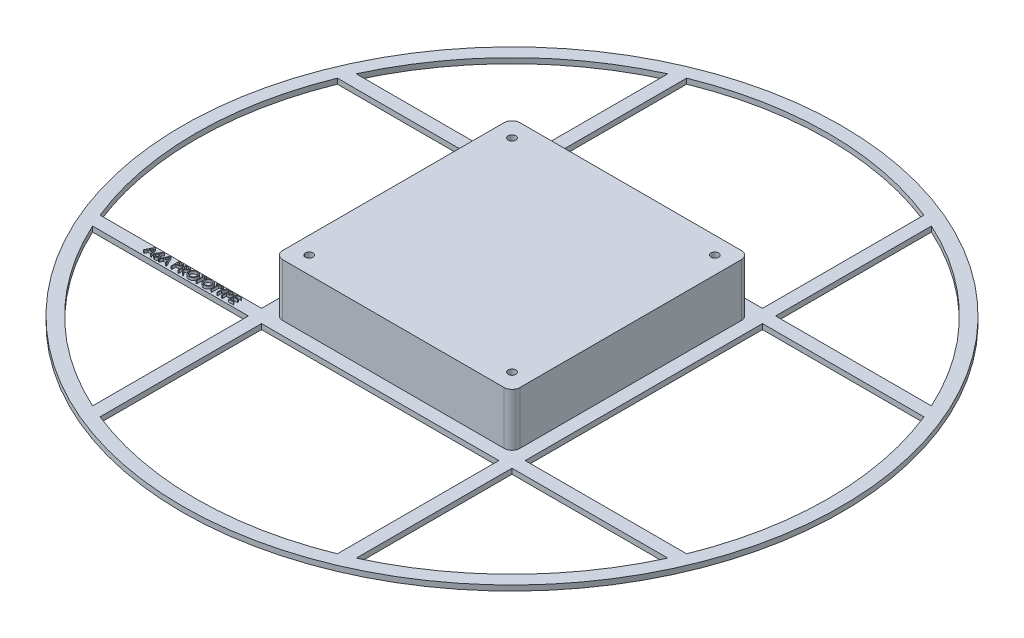
from build123d import *

# Parameters (mm, degrees)
SKETCH1_R                                     = 125
SKETCH1_R_2                                   = 120
BOSS_EXTRUDE1_DEPTH                           = 2
SKETCH1_W                                     = 100
SKETCH1_H                                     = 100
BOSS_EXTRUDE1_2_DEPTH                         = 2
BOSS_EXTRUDE2_REACH                           = 217.067
BOSS_EXTRUDE2_END_RADIUS                      = 120
SKETCH2_W                                     = 5
SKETCH2_H                                     = 2
MIRROR1_AT_THE_SECOND_PLANE_COPY_1_REACH      = 217.067
MIRROR1_AT_THE_SECOND_PLANE_COPY_1_END_RADIUS = 120
MIRROR1_AT_THE_SECOND_PLANE_COPY_1_SKETC_W    = 5
MIRROR1_AT_THE_SECOND_PLANE_COPY_1_SKETC_H    = 2
MIRROR3_COPY_1_REACH                          = 217.067
MIRROR3_COPY_1_END_RADIUS                     = 120
MIRROR3_COPY_1_SKETCH_W                       = 5
MIRROR3_COPY_1_SKETCH_H                       = 2
MIRROR3_COPY_2_REACH                          = 217.067
MIRROR3_COPY_2_END_RADIUS                     = 120
MIRROR3_COPY_2_SKETCH_W                       = 5
MIRROR3_COPY_2_SKETCH_H                       = 2
MIRROR3_COPY_3_REACH                          = 217.067
MIRROR3_COPY_3_END_RADIUS                     = 120
MIRROR3_COPY_3_SKETCH_W                       = 5
MIRROR3_COPY_3_SKETCH_H                       = 2
SKETCH8_W                                     = 90
SKETCH8_H                                     = 90
BOSS_EXTRUDE3_DEPTH                           = 20
FILLET1_R                                     = 3
SKETCH9_R                                     = 1.45
CUT_EXTRUDE1_DEPTH                            = 15
BOSS_EXTRUDE4_DEPTH                           = 1


with BuildPart() as part:
    # Sketch1 → Boss-Extrude1 (new body)
    with BuildSketch(Plane(origin=(0, 0, 0), x_dir=(1, 0, 0), z_dir=(0, 1, 0))):
        with Locations(Location((0, 0, 0), (0, 0, 270))):
            Circle(SKETCH1_R)
        with Locations(Location((0, 0, 0), (0, 0, 270))):
            Circle(SKETCH1_R_2, mode=Mode.SUBTRACT)
    extrude(amount=BOSS_EXTRUDE1_DEPTH)



with BuildPart() as body_2:
    # Sketch1 → Boss-Extrude1 2 (new body)
    with BuildSketch(Plane(origin=(0, 0, 0), x_dir=(1, 0, 0), z_dir=(0, 1, 0))):
        Rectangle(SKETCH1_W, SKETCH1_H)
    extrude(amount=BOSS_EXTRUDE1_2_DEPTH)


with BuildPart() as part_1:
    add(part.part)

    add(body_2.part)  # Boss-Extrude2 merges body 2
    # Boss-Extrude2: up to this cylinder (the profile starts inside it)
    boss_extrude2_end = Plane(origin=(0, 1, 0), z_dir=(0, -1, 0)) * Cylinder(BOSS_EXTRUDE2_END_RADIUS, 675.134, mode=Mode.PRIVATE)
    # Sketch2 → Boss-Extrude2 (add, up to the surface)
    with BuildSketch(Plane.ZY.offset(50), mode=Mode.PRIVATE) as boss_extrude2_sk1:
        with Locations((-47.5, 1)):
            Rectangle(SKETCH2_W, SKETCH2_H)
    boss_extrude2_tool1 = extrude(boss_extrude2_sk1.sketch, amount=BOSS_EXTRUDE2_REACH, mode=Mode.PRIVATE) & boss_extrude2_end
    boss_extrude2 = boss_extrude2_tool1.solids().sort_by_distance((-50, 1, -47.5))[0]
    add(boss_extrude2)

    # Mirror1: Boss-Extrude2 across plane
    add(boss_extrude2.mirror(Plane(origin=(0, 0, 0), x_dir=(0, 0, 1), z_dir=(1, 0, 0))))

    # Mirror1 at the second plane: Boss-Extrude2 across plane
    add(boss_extrude2.mirror(Plane.XY))

    # Mirror1 at the second plane copy 1: up to this cylinder (the profile starts inside it)
    mirror1_at_the_second_plane_copy_1_end = Plane(origin=(0, 1, 0), z_dir=(0, -1, 0)) * Cylinder(MIRROR1_AT_THE_SECOND_PLANE_COPY_1_END_RADIUS, 675.134, mode=Mode.PRIVATE)
    # Mirror1 at the second plane copy 1 sketc → Mirror1 at the second plane copy 1 (add, up to the surface)
    with BuildSketch(Plane(origin=(50, 0, 0), x_dir=(0, 0, -1), z_dir=(1, 0, 0)), mode=Mode.PRIVATE) as mirror1_at_the_second_plane_copy_1_sk1:
        with Locations((-47.5, 1)):
            Rectangle(MIRROR1_AT_THE_SECOND_PLANE_COPY_1_SKETC_W, MIRROR1_AT_THE_SECOND_PLANE_COPY_1_SKETC_H)
    mirror1_at_the_second_plane_copy_1_tool1 = extrude(mirror1_at_the_second_plane_copy_1_sk1.sketch, amount=MIRROR1_AT_THE_SECOND_PLANE_COPY_1_REACH, mode=Mode.PRIVATE) & mirror1_at_the_second_plane_copy_1_end
    add(mirror1_at_the_second_plane_copy_1_tool1.solids().sort_by_distance((-50, 1, -47.5))[0])

    # Mirror2: Boss-Extrude2 across plane
    add(boss_extrude2.mirror(Plane(origin=(0, 0, 0), x_dir=(-0.7071067811865414, 0, 0.7071067811865536), z_dir=(-0.7071067811865537, 0, -0.7071067811865414))))

    # Mirror2 at the second plane: Boss-Extrude2 across plane
    add(boss_extrude2.mirror(Plane(origin=(0, 0, 0), x_dir=(0.7071067811865538, 0, 0.7071067811865412), z_dir=(-0.7071067811865412, 0, 0.7071067811865538))))

    # Mirror3 copy 1: up to this cylinder (the profile starts inside it)
    mirror3_copy_1_end = Plane(origin=(0, 1, 0), z_dir=(0, -1, 0)) * Cylinder(MIRROR3_COPY_1_END_RADIUS, 675.134, mode=Mode.PRIVATE)
    # Mirror3 copy 1 sketch → Mirror3 copy 1 (add, up to the surface)
    with BuildSketch(Plane.XY.offset(50), mode=Mode.PRIVATE) as mirror3_copy_1_sk1:
        with Locations((-47.5, 1)):
            Rectangle(MIRROR3_COPY_1_SKETCH_W, MIRROR3_COPY_1_SKETCH_H)
    mirror3_copy_1_tool1 = extrude(mirror3_copy_1_sk1.sketch, amount=MIRROR3_COPY_1_REACH, mode=Mode.PRIVATE) & mirror3_copy_1_end
    add(mirror3_copy_1_tool1.solids().sort_by_distance((-50, 1, -47.5))[0])

    # Mirror3 copy 2: up to this cylinder (the profile starts inside it)
    mirror3_copy_2_end = Plane(origin=(0, 1, 0), z_dir=(0, -1, 0)) * Cylinder(MIRROR3_COPY_2_END_RADIUS, 675.134, mode=Mode.PRIVATE)
    # Mirror3 copy 2 sketch → Mirror3 copy 2 (add, up to the surface)
    with BuildSketch(Plane(origin=(0, 0, -50), x_dir=(-1, 0, 0), z_dir=(0, 0, -1)), mode=Mode.PRIVATE) as mirror3_copy_2_sk1:
        with Locations((-47.5, 1)):
            Rectangle(MIRROR3_COPY_2_SKETCH_W, MIRROR3_COPY_2_SKETCH_H)
    mirror3_copy_2_tool1 = extrude(mirror3_copy_2_sk1.sketch, amount=MIRROR3_COPY_2_REACH, mode=Mode.PRIVATE) & mirror3_copy_2_end
    add(mirror3_copy_2_tool1.solids().sort_by_distance((-50, 1, -47.5))[0])

    # Mirror3 copy 3: up to this cylinder (the profile starts inside it)
    mirror3_copy_3_end = Plane(origin=(0, 1, 0), z_dir=(0, -1, 0)) * Cylinder(MIRROR3_COPY_3_END_RADIUS, 675.134, mode=Mode.PRIVATE)
    # Mirror3 copy 3 sketch → Mirror3 copy 3 (add, up to the surface)
    with BuildSketch(Plane(origin=(50, 0, 0), x_dir=(0, 0, 1), z_dir=(1, 0, 0)), mode=Mode.PRIVATE) as mirror3_copy_3_sk1:
        with Locations((-47.5, -1)):
            Rectangle(MIRROR3_COPY_3_SKETCH_W, MIRROR3_COPY_3_SKETCH_H)
    mirror3_copy_3_tool1 = extrude(mirror3_copy_3_sk1.sketch, amount=MIRROR3_COPY_3_REACH, mode=Mode.PRIVATE) & mirror3_copy_3_end
    add(mirror3_copy_3_tool1.solids().sort_by_distance((-50, 1, -47.5))[0])

    # Sketch8 → Boss-Extrude3 (add)
    with BuildSketch(Plane(origin=(0, 2, 0), x_dir=(1, 0, 0), z_dir=(0, 1, 0))):
        Rectangle(SKETCH8_W, SKETCH8_H)
    extrude(amount=BOSS_EXTRUDE3_DEPTH)

    # Fillet1
    fillet1_edges = [part_1.edges().sort_by_distance(p)[0] for p in [
        (-45, 12, -45),
        (-45, 12, 45),
        (45, 12, 45),
        (45, 12, -45),
    ]]
    fillet(fillet1_edges, radius=FILLET1_R)

    # Sketch9 → Cut-Extrude1 (cut)
    with BuildSketch(Plane(origin=(0, 22, 0), x_dir=(1, 0, 0), z_dir=(0, 1, 0))):
        with Locations(Location((-38.464466094, 38.464466094, 0), (0, 0, 270))):
            Circle(SKETCH9_R)
        with Locations(Location((38.464466094, 38.464466094, 0), (0, 0, 270))):
            Circle(SKETCH9_R)
        with Locations(Location((38.464466094, -38.464466094, 0), (0, 0, 270))):
            Circle(SKETCH9_R)
        with Locations(Location((-38.464466094, -38.464466094, 0), (0, 0, 270))):
            Circle(SKETCH9_R)
    extrude(amount=-CUT_EXTRUDE1_DEPTH, mode=Mode.SUBTRACT)

    # Sketch11 → Boss-Extrude4 (add)
    # profile 1 of 12: a face of its own
    with BuildSketch(Plane(origin=(0, 2, 0), x_dir=(1, 0, 0), z_dir=(0, 1, 0))):
        Polygon((-89.096375397, -46.03001149), (-87.630990782, -49.20501149), (-87.940731367, -49.20501149), (-88.410112376, -48.187383284), (-89.849420269, -48.187383284), (-90.331521631, -49.20501149), (-90.643170269, -49.20501149), (-89.137080525, -46.03001149), align=None)
        Polygon((-89.119908049, -46.649492659), (-89.694231968, -47.861742259), (-88.560212537, -47.861742259), align=None, mode=Mode.SUBTRACT)
    # profile 2 of 12: a face of its own
    with BuildSketch(Plane(origin=(0, 2, 0), x_dir=(1, 0, 0), z_dir=(0, 1, 0))):
        with BuildLine():
            Line((-85.880670269, -45.948601233), (-85.66060817, -46.12096201))
            Line((-85.66060817, -46.12096201), (-86.499515421, -47.403809567))
            add(Edge.make_bspline(
                [(-86.499515421, -47.403809567), (-86.443662384, -47.394906993), (-86.334714721, -47.377541517), (-86.224437084, -47.374676809), (-86.170694307, -47.37328072)],
                knots=[0, 0, 0, 0, 1.025318673, 2, 2, 2, 2], degree=3))
            add(Edge.make_bspline(
                [(-86.170694307, -47.37328072), (-86.138423347, -47.374135489), (-86.075109031, -47.375812509), (-85.98207751, -47.389065485), (-85.892662803, -47.409693669), (-85.807064384, -47.439884269), (-85.725173615, -47.47843787), (-85.646522231, -47.524647274), (-85.572588244, -47.580895127), (-85.50241968, -47.64372838), (-85.438713669, -47.713321633), (-85.382311105, -47.787164277), (-85.334933943, -47.865179361), (-85.296494743, -47.947327376), (-85.266645318, -48.03348169), (-85.244885097, -48.123532073), (-85.23202218, -48.217540623), (-85.230275485, -48.281474396), (-85.229388218, -48.313950792)],
                knots=[0, 0, 0, 0, 1.044136307, 2.048553127, 3.035567123, 4.010001674, 4.980053131, 5.96154148, 6.956538004, 7.981742224, 9.006487041, 10.005615874, 10.984750588, 11.954802044, 12.935714515, 13.930994945, 14.949008866, 16, 16, 16, 16], degree=3))
            add(Edge.make_bspline(
                [(-85.229388218, -48.313950792), (-85.230679177, -48.358382381), (-85.23321948, -48.445813232), (-85.258532209, -48.573154959), (-85.297865601, -48.694469455), (-85.354088073, -48.807819832), (-85.423922092, -48.913050734), (-85.50908248, -49.006291835), (-85.606549073, -49.089449655), (-85.716754954, -49.158988159), (-85.8353575, -49.21577807), (-85.959955383, -49.256567968), (-86.08933858, -49.28168083), (-86.177154189, -49.284829162), (-86.221575718, -49.286421746)],
                knots=[0, 0, 0, 0, 1.031375318, 2.029502543, 3.004789286, 3.987476834, 4.960371455, 5.9300674, 6.912260825, 7.929083631, 8.949397511, 9.960523116, 10.96833055, 12, 12, 12, 12], degree=3))
            add(Edge.make_bspline(
                [(-86.221575718, -49.286421746), (-86.264299153, -49.285035445), (-86.348926799, -49.282289426), (-86.473416548, -49.257827468), (-86.593035142, -49.218178882), (-86.706944509, -49.163555929), (-86.812463922, -49.094560564), (-86.906866321, -49.011500496), (-86.989681002, -48.916151196), (-87.058600837, -48.808527452), (-87.113264115, -48.692875848), (-87.154257833, -48.572282856), (-87.178202997, -48.447187873), (-87.181549045, -48.362387125), (-87.183234372, -48.319674951)],
                knots=[0, 0, 0, 0, 1.012016664, 2.004627821, 2.994792927, 3.992885782, 4.990978636, 5.973936114, 6.964471063, 7.975201453, 8.993600317, 9.990122807, 10.98767138, 12, 12, 12, 12], degree=3))
            add(Edge.make_bspline(
                [(-87.183234372, -48.319674951), (-87.182162632, -48.286977365), (-87.179974345, -48.220215141), (-87.164694984, -48.119101345), (-87.140143349, -48.01564072), (-87.112647625, -47.927870845), (-87.083595822, -47.855969321), (-87.059418161, -47.797999726), (-87.029324607, -47.738345038), (-86.997235897, -47.674959669), (-86.960263595, -47.609477169), (-86.92006297, -47.540803126), (-86.875522572, -47.47002972), (-86.844298567, -47.422001772), (-86.828336535, -47.39744939)],
                knots=[0, 0, 0, 0, 1.173818275, 2.396712641, 3.66331629, 4.989737886, 5.693666774, 6.447286557, 7.243889047, 8.091586357, 8.998013824, 9.943181721, 10.948533338, 12, 12, 12, 12], degree=3))
            Line((-86.828336535, -47.39744939), (-85.880670269, -45.948601233))
        make_face()
        with BuildLine():
            add(Edge.make_bspline(
                [(-86.230479964, -47.698921746), (-86.254665656, -47.699636909), (-86.302117783, -47.701040052), (-86.371649339, -47.708964606), (-86.437277824, -47.723980722), (-86.499757166, -47.743400405), (-86.558420474, -47.769856443), (-86.613994988, -47.801558291), (-86.665841077, -47.839539888), (-86.713705654, -47.882416824), (-86.757079985, -47.929404373), (-86.794438439, -47.979720965), (-86.826661997, -48.032167274), (-86.852862021, -48.087178029), (-86.873263709, -48.144733108), (-86.888021343, -48.204567559), (-86.896234387, -48.267082683), (-86.897600754, -48.309475738), (-86.898298474, -48.331123268)],
                knots=[0, 0, 0, 0, 1.128956033, 2.215002439, 3.259141796, 4.2666399, 5.263148119, 6.255916712, 7.247353359, 8.256307737, 9.250603402, 10.226115518, 11.176314381, 12.118911324, 13.063945463, 14.021379252, 14.989639887, 16, 16, 16, 16], degree=3))
            add(Edge.make_bspline(
                [(-86.898298474, -48.331123268), (-86.897730275, -48.352577179), (-86.89661612, -48.394645103), (-86.886499373, -48.456638502), (-86.87104612, -48.516296669), (-86.848058761, -48.573312047), (-86.820638655, -48.628553707), (-86.784438825, -48.680020716), (-86.744327884, -48.730838923), (-86.696381816, -48.777104543), (-86.644925622, -48.820154481), (-86.589951674, -48.857782997), (-86.532656568, -48.889974025), (-86.472266778, -48.915202664), (-86.409639101, -48.935907553), (-86.344251741, -48.950477609), (-86.276059222, -48.958714943), (-86.22986575, -48.96008309), (-86.206311295, -48.96078072)],
                knots=[0, 0, 0, 0, 0.989467248, 1.94019797, 2.891935182, 3.827694429, 4.772920941, 5.730924762, 6.725747692, 7.756678648, 8.79901574, 9.819492441, 10.826891316, 11.826466727, 12.835195252, 13.867842842, 14.912794438, 16, 16, 16, 16], degree=3))
            add(Edge.make_bspline(
                [(-86.206311295, -48.96078072), (-86.182756878, -48.960083036), (-86.136563481, -48.958714781), (-86.068370414, -48.950478224), (-86.002985082, -48.935905294), (-85.940350035, -48.915210852), (-85.879987451, -48.889943649), (-85.822742454, -48.857983265), (-85.768288397, -48.819923072), (-85.716798425, -48.777178112), (-85.669051924, -48.730575597), (-85.627978964, -48.680474349), (-85.592887745, -48.628137744), (-85.564372447, -48.573529658), (-85.541638275, -48.516262194), (-85.526106659, -48.456647737), (-85.516010804, -48.394642685), (-85.514893778, -48.352576362), (-85.514324115, -48.331123268)],
                knots=[0, 0, 0, 0, 1.087397944, 2.132534446, 3.165364764, 4.174271784, 5.174024072, 6.181601208, 7.194203697, 8.236725232, 9.267838612, 10.269026844, 11.221737037, 12.171628256, 13.107553087, 14.05945871, 15.010357665, 16, 16, 16, 16], degree=3))
            add(Edge.make_bspline(
                [(-85.514324115, -48.331123268), (-85.51482331, -48.309447498), (-85.515803068, -48.266905011), (-85.526884669, -48.204595514), (-85.542253856, -48.14442913), (-85.565461194, -48.08678368), (-85.595611965, -48.031887834), (-85.632334361, -47.97945972), (-85.674825399, -47.929115186), (-85.72387151, -47.882296389), (-85.777261952, -47.839804245), (-85.833669118, -47.801415702), (-85.893444065, -47.770151535), (-85.955508292, -47.74331042), (-86.020609347, -47.724288548), (-86.088036143, -47.708917723), (-86.15842759, -47.701106299), (-86.206296427, -47.699654966), (-86.230479964, -47.698921746)],
                knots=[0, 0, 0, 0, 0.978753431, 1.920974676, 2.853199117, 3.782215702, 4.721507756, 5.67862441, 6.671401678, 7.694929396, 8.738190014, 9.75360867, 10.774035531, 11.783329636, 12.805060902, 13.835252836, 14.906360638, 16, 16, 16, 16], degree=3))
        make_face(mode=Mode.SUBTRACT)
    # profile 3 of 12: a face of its own
    with BuildSketch(Plane(origin=(0, 2, 0), x_dir=(1, 0, 0), z_dir=(0, 1, 0))):
        Polygon((-83.316247192, -46.03001149), (-81.850862577, -49.20501149), (-82.160603162, -49.20501149), (-82.629984171, -48.187383284), (-84.069292064, -48.187383284), (-84.551393426, -49.20501149), (-84.863042064, -49.20501149), (-83.35695232, -46.03001149), align=None)
        Polygon((-83.339779844, -46.649492659), (-83.914103763, -47.861742259), (-82.780084331, -47.861742259), align=None, mode=Mode.SUBTRACT)
    # profile 4 of 12: a face of its own
    with BuildSketch(Plane(origin=(0, 2, 0), x_dir=(1, 0, 0), z_dir=(0, 1, 0))):
        with BuildLine():
            Line((-80.059836936, -46.03001149), (-79.437175678, -46.03001149))
            add(Edge.make_bspline(
                [(-79.437175678, -46.03001149), (-79.394348641, -46.030058567), (-79.312290138, -46.030148769), (-79.194620052, -46.032883574), (-79.087749795, -46.036536359), (-78.991909807, -46.041599934), (-78.906805203, -46.047583983), (-78.832821082, -46.055976905), (-78.769375913, -46.064740173), (-78.731360776, -46.073649592), (-78.714023634, -46.077712812)],
                knots=[0, 0, 0, 0, 1.415646017, 2.712440637, 3.8905458, 4.950247383, 5.884950622, 6.709939814, 7.411656543, 8, 8, 8, 8], degree=3))
            add(Edge.make_bspline(
                [(-78.714023634, -46.077712812), (-78.692076643, -46.083719866), (-78.648699814, -46.095592426), (-78.586196725, -46.119372018), (-78.526730022, -46.147567983), (-78.47009568, -46.179702557), (-78.416989647, -46.217154461), (-78.366619596, -46.258405529), (-78.319430042, -46.304408166), (-78.275686351, -46.354646409), (-78.235513713, -46.408276885), (-78.200924644, -46.466100193), (-78.171962088, -46.527143018), (-78.147121549, -46.591362901), (-78.129243165, -46.659299123), (-78.115774906, -46.730479641), (-78.107226329, -46.804896824), (-78.106407577, -46.855751132), (-78.105990782, -46.881639094)],
                knots=[0, 0, 0, 0, 0.999701418, 1.975846123, 2.934577507, 3.890451536, 4.834027766, 5.787354733, 6.749476667, 7.726910423, 8.712836071, 9.690891519, 10.682875813, 11.679750201, 12.712814741, 13.765529915, 14.8625177, 16, 16, 16, 16], degree=3))
            add(Edge.make_bspline(
                [(-78.105990782, -46.881639094), (-78.106373074, -46.907744648), (-78.107121055, -46.958821929), (-78.1160984, -47.033545816), (-78.128190788, -47.104954641), (-78.146784542, -47.172890071), (-78.171137403, -47.236948663), (-78.199705194, -47.298109352), (-78.234161682, -47.355331626), (-78.273753778, -47.408823225), (-78.31779701, -47.45863436), (-78.366105032, -47.504404066), (-78.418482819, -47.545864431), (-78.47476391, -47.583108399), (-78.535496988, -47.61527231), (-78.599760941, -47.644080722), (-78.668114352, -47.668275185), (-78.715415061, -47.681002455), (-78.739464339, -47.687473429)],
                knots=[0, 0, 0, 0, 1.121902311, 2.195077645, 3.232258892, 4.234102512, 5.217864754, 6.176164875, 7.132989551, 8.084763148, 9.034132444, 9.988522005, 10.94243251, 11.903244335, 12.886203696, 13.894208494, 14.929344452, 16, 16, 16, 16], degree=3))
            add(Edge.make_bspline(
                [(-78.739464339, -47.687473429), (-78.759355564, -47.691703419), (-78.802948339, -47.700973688), (-78.874742094, -47.711322788), (-78.958331122, -47.720156183), (-79.053601334, -47.726779357), (-79.160467212, -47.732449335), (-79.278986566, -47.736956105), (-79.409392051, -47.739432473), (-79.500352394, -47.739560192), (-79.547842745, -47.739626874)],
                knots=[0, 0, 0, 0, 0.601384939, 1.31797006, 2.144135048, 3.087295005, 4.142315834, 5.309527816, 6.595305764, 8, 8, 8, 8], degree=3))
            Line((-79.547842745, -47.739626874), (-79.774901038, -47.739626874))
            Line((-79.774901038, -47.739626874), (-79.774901038, -49.20501149))
            Line((-79.774901038, -49.20501149), (-80.059836936, -49.20501149))
            Line((-80.059836936, -49.20501149), (-80.059836936, -46.03001149))
        make_face()
        with BuildLine():
            Line((-79.774901038, -46.355652515), (-79.774901038, -47.413985849))
            Line((-79.774901038, -47.413985849), (-79.219021631, -47.420982042))
            add(Edge.make_bspline(
                [(-79.219021631, -47.420982042), (-79.191879984, -47.42099607), (-79.139483594, -47.42102315), (-79.06379502, -47.417407983), (-78.993573738, -47.413234643), (-78.929035445, -47.407124198), (-78.870151047, -47.398487057), (-78.81682236, -47.389767838), (-78.769462896, -47.377153688), (-78.714037192, -47.360169189), (-78.65227587, -47.331201745), (-78.585086022, -47.289155773), (-78.528144133, -47.235561131), (-78.478869678, -47.175301598), (-78.439766489, -47.108264531), (-78.411140696, -47.03653771), (-78.394321217, -46.960856732), (-78.392065885, -46.909069634), (-78.390926679, -46.882911129)],
                knots=[0, 0, 0, 0, 1.160613943, 2.240541288, 3.23993089, 4.169200891, 5.011653406, 5.7853311, 6.478053781, 7.106038997, 8.262395093, 9.384106736, 10.481365981, 11.59014053, 12.70357646, 13.786202915, 14.881775077, 16, 16, 16, 16], degree=3))
            add(Edge.make_bspline(
                [(-78.390926679, -46.882911129), (-78.39207208, -46.857385478), (-78.394348995, -46.806643642), (-78.411272528, -46.732277194), (-78.439710834, -46.661306234), (-78.479132173, -46.595109221), (-78.526975913, -46.53506652), (-78.582583174, -46.482908412), (-78.645823061, -46.440978725), (-78.704649671, -46.413915676), (-78.756902175, -46.397391819), (-78.80228831, -46.385830428), (-78.853533422, -46.3765997), (-78.910654193, -46.369125294), (-78.973207893, -46.362726797), (-79.041731935, -46.358385232), (-79.11596674, -46.355843911), (-79.167502044, -46.355717858), (-79.194216944, -46.355652515)],
                knots=[0, 0, 0, 0, 1.120700087, 2.227813068, 3.331159281, 4.466773991, 5.599788987, 6.693661531, 7.80175334, 8.91857717, 9.525282508, 10.207424825, 10.974604443, 11.810962634, 12.737642355, 13.736264703, 14.826523623, 16, 16, 16, 16], degree=3))
            Line((-79.194216944, -46.355652515), (-79.774901038, -46.355652515))
        make_face(mode=Mode.SUBTRACT)
    # profile 5 of 12: a face of its own
    with BuildSketch(Plane(origin=(0, 2, 0), x_dir=(1, 0, 0), z_dir=(0, 1, 0))):
        with BuildLine():
            Line((-77.45470873, -46.03001149), (-76.81932712, -46.03001149))
            add(Edge.make_bspline(
                [(-76.81932712, -46.03001149), (-76.776926239, -46.030152628), (-76.695511851, -46.03042363), (-76.578877527, -46.031934715), (-76.472898661, -46.036265738), (-76.377630663, -46.03999281), (-76.293075284, -46.046789071), (-76.218973241, -46.053284801), (-76.15566583, -46.06178805), (-76.117342808, -46.069685113), (-76.099991182, -46.073260688)],
                knots=[0, 0, 0, 0, 1.410062039, 2.707475311, 3.878576406, 4.937260626, 5.877586885, 6.699081471, 7.410979367, 8, 8, 8, 8], degree=3))
            add(Edge.make_bspline(
                [(-76.099991182, -46.073260688), (-76.076762316, -46.078999968), (-76.030800119, -46.090356094), (-75.964623987, -46.114358732), (-75.901564565, -46.142135106), (-75.841883796, -46.174759338), (-75.785880614, -46.212473602), (-75.732977575, -46.254626827), (-75.682934619, -46.300988364), (-75.637775568, -46.352727113), (-75.595195143, -46.407007375), (-75.559282603, -46.465702926), (-75.528325011, -46.527081598), (-75.50367747, -46.591767612), (-75.483831023, -46.659133648), (-75.46983722, -46.729789914), (-75.461445071, -46.803414513), (-75.460590674, -46.853632044), (-75.460157448, -46.879095023)],
                knots=[0, 0, 0, 0, 1.027469482, 2.033020251, 3.019912614, 3.986113645, 4.951240523, 5.91722682, 6.890402269, 7.87763091, 8.8651537, 9.85103654, 10.82876324, 11.815024772, 12.821070561, 13.842952187, 14.906261191, 16, 16, 16, 16], degree=3))
            add(Edge.make_bspline(
                [(-75.460157448, -46.879095023), (-75.46149004, -46.921399725), (-75.46409027, -47.003947156), (-75.488333757, -47.123745241), (-75.528045314, -47.235495548), (-75.582767155, -47.33905737), (-75.652453394, -47.432412027), (-75.736205168, -47.514409083), (-75.834069202, -47.583025289), (-75.925172938, -47.630607476), (-76.005649391, -47.661081043), (-76.071901039, -47.682522597), (-76.144170368, -47.699088809), (-76.221764951, -47.713929785), (-76.305007695, -47.725134537), (-76.393699088, -47.73334109), (-76.487902383, -47.73847012), (-76.55261711, -47.739233939), (-76.58590865, -47.739626874)],
                knots=[0, 0, 0, 0, 1.260483769, 2.459530307, 3.627416485, 4.787058657, 5.939039949, 7.08810263, 8.267026773, 9.491475466, 10.141966685, 10.831826277, 11.566392101, 12.351337768, 13.187381173, 14.07005841, 15.007169909, 16, 16, 16, 16], degree=3))
            Line((-76.58590865, -47.739626874), (-75.41945232, -49.20501149))
            Line((-75.41945232, -49.20501149), (-75.771806086, -49.20501149))
            Line((-75.771806086, -49.20501149), (-76.938262416, -47.739626874))
            Line((-76.938262416, -47.739626874), (-77.169772833, -47.739626874))
            Line((-77.169772833, -47.739626874), (-77.169772833, -49.20501149))
            Line((-77.169772833, -49.20501149), (-77.45470873, -49.20501149))
            Line((-77.45470873, -49.20501149), (-77.45470873, -46.03001149))
        make_face()
        with BuildLine():
            Line((-77.169772833, -46.355652515), (-77.169772833, -47.413985849))
            Line((-77.169772833, -47.413985849), (-76.588452721, -47.418437972))
            add(Edge.make_bspline(
                [(-76.588452721, -47.418437972), (-76.561310971, -47.418449979), (-76.50870253, -47.418473254), (-76.432592641, -47.414850328), (-76.36172654, -47.410728889), (-76.296375286, -47.40442484), (-76.236509686, -47.396300404), (-76.182159661, -47.386137696), (-76.133236492, -47.374297611), (-76.076178533, -47.35597185), (-76.012463965, -47.32693782), (-75.943220426, -47.28469626), (-75.88425402, -47.231565702), (-75.834435673, -47.17081121), (-75.794403975, -47.104012613), (-75.766180897, -47.031970621), (-75.748271681, -46.956503957), (-75.746159358, -46.904635244), (-75.745093346, -46.878459006)],
                knots=[0, 0, 0, 0, 1.146690395, 2.22261258, 3.21895312, 4.145990853, 4.996080663, 5.770904154, 6.481378293, 7.121626537, 8.300444488, 9.431385265, 10.535395872, 11.636531494, 12.74115979, 13.810798291, 14.895190096, 16, 16, 16, 16], degree=3))
            add(Edge.make_bspline(
                [(-75.745093346, -46.878459006), (-75.746183841, -46.852926042), (-75.748344806, -46.802329026), (-75.765987617, -46.72825545), (-75.795822985, -46.658344717), (-75.836029586, -46.59288122), (-75.885014534, -46.533458159), (-75.942452835, -46.482615385), (-76.006773977, -46.440660513), (-76.066891421, -46.413850468), (-76.120625314, -46.397413172), (-76.167279362, -46.385846045), (-76.219994774, -46.376552849), (-76.279027512, -46.369106965), (-76.344125563, -46.362707122), (-76.415618082, -46.35839658), (-76.493030732, -46.355844004), (-76.546685449, -46.35571783), (-76.574460333, -46.355652515)],
                knots=[0, 0, 0, 0, 1.101028733, 2.181837193, 3.264309656, 4.369019818, 5.486613113, 6.575447106, 7.666700264, 8.788928104, 9.402425223, 10.0903467, 10.862060571, 11.710948788, 12.657782767, 13.684531032, 14.801375019, 16, 16, 16, 16], degree=3))
            Line((-76.574460333, -46.355652515), (-77.169772833, -46.355652515))
        make_face(mode=Mode.SUBTRACT)
    # profile 6 of 12: a face of its own
    with BuildSketch(Plane(origin=(0, 2, 0), x_dir=(1, 0, 0), z_dir=(0, 1, 0))):
        with BuildLine():
            add(Edge.make_bspline(
                [(-73.282433089, -45.948601233), (-73.223642879, -45.950090289), (-73.108174056, -45.953014919), (-72.938470398, -45.975402391), (-72.776459133, -46.014133209), (-72.620820507, -46.065716058), (-72.473416164, -46.134526822), (-72.333136598, -46.217698349), (-72.200315576, -46.316101994), (-72.076743323, -46.428977078), (-71.963661661, -46.551789211), (-71.864033893, -46.682851316), (-71.780538383, -46.821370943), (-71.711971277, -46.96693184), (-71.658178966, -47.119204811), (-71.621059548, -47.279001656), (-71.597348512, -47.445287011), (-71.594576485, -47.558704238), (-71.593170269, -47.616239454)],
                knots=[0, 0, 0, 0, 1.065120563, 2.091984664, 3.0946048, 4.079830382, 5.057816894, 6.036188127, 7.030412546, 8.04752943, 9.064399622, 10.05169764, 11.02544977, 11.989514704, 12.962713494, 13.945757189, 14.957906945, 16, 16, 16, 16], degree=3))
            add(Edge.make_bspline(
                [(-71.593170269, -47.616239454), (-71.594576279, -47.673350852), (-71.597347688, -47.785924033), (-71.621086508, -47.951154158), (-71.658316558, -48.109986433), (-71.711471742, -48.262155703), (-71.779711998, -48.407822493), (-71.863763474, -48.546603516), (-71.962770144, -48.678544268), (-72.075443502, -48.802199328), (-72.19827159, -48.915589891), (-72.330016189, -49.014394871), (-72.467714415, -49.099416041), (-72.613138222, -49.167255517), (-72.764358969, -49.221477188), (-72.922730077, -49.258445645), (-73.087509451, -49.282291748), (-73.199878147, -49.285029974), (-73.256992384, -49.286421746)],
                knots=[0, 0, 0, 0, 1.043624062, 2.057103931, 3.04512605, 4.022047818, 4.998200453, 5.980619268, 6.982898556, 8.009068085, 9.034988726, 10.034168286, 11.015286542, 11.987931943, 12.962482838, 13.94673481, 14.956375938, 16, 16, 16, 16], degree=3))
            add(Edge.make_bspline(
                [(-73.256992384, -49.286421746), (-73.314527302, -49.285016231), (-73.427943941, -49.282245586), (-73.594438252, -49.258495312), (-73.754347348, -49.2213557), (-73.907213938, -49.168279283), (-74.053123267, -49.099683653), (-74.192360699, -49.016041109), (-74.324367354, -48.916793202), (-74.448048796, -48.804156381), (-74.56121414, -48.681536473), (-74.65987443, -48.550151113), (-74.743535783, -48.412577949), (-74.811901092, -48.268435195), (-74.86602528, -48.118419672), (-74.902950365, -47.961530696), (-74.926840836, -47.798662715), (-74.929593875, -47.687770943), (-74.930990782, -47.631503877)],
                knots=[0, 0, 0, 0, 1.053102029, 2.075944431, 3.073151272, 4.055350789, 5.033113405, 6.020478099, 7.024410459, 8.052272461, 9.079885166, 10.07527673, 11.055994387, 12.023226415, 12.992069828, 13.970394897, 14.97016774, 16, 16, 16, 16], degree=3))
            add(Edge.make_bspline(
                [(-74.930990782, -47.631503877), (-74.930505791, -47.593737099), (-74.929541928, -47.518679987), (-74.917938035, -47.407222428), (-74.901099921, -47.297557332), (-74.876968186, -47.189996543), (-74.845407174, -47.084803364), (-74.80816712, -46.981252315), (-74.762683118, -46.880392794), (-74.711265673, -46.781747003), (-74.653878175, -46.686852688), (-74.590490888, -46.597154781), (-74.523330233, -46.511900591), (-74.44970344, -46.43329938), (-74.372037093, -46.359064563), (-74.289071279, -46.290336956), (-74.201312243, -46.226496822), (-74.10838237, -46.168965512), (-74.012571506, -46.116932583), (-73.913804715, -46.072281333), (-73.813423396, -46.03395812), (-73.710957394, -46.0028968), (-73.606678808, -45.978374881), (-73.500360046, -45.961676782), (-73.39208581, -45.950043293), (-73.319141256, -45.949083988), (-73.282433089, -45.948601233)],
                knots=[0, 0, 0, 0, 1.037015668, 2.060948919, 3.074880161, 4.083647147, 5.086022904, 6.090072063, 7.104153813, 8.122640571, 9.144368836, 10.147691507, 11.138137339, 12.123020368, 13.103399296, 14.087645067, 15.080126199, 16.082011238, 17.087798457, 18.072939717, 19.057185487, 20.037253025, 21.01195951, 21.997135196, 22.992090687, 24, 24, 24, 24], degree=3))
        make_face()
        with BuildLine():
            add(Edge.make_bspline(
                [(-73.268440702, -46.274242259), (-73.298571119, -46.274609552), (-73.358543906, -46.275340627), (-73.447702021, -46.284970598), (-73.535687561, -46.298695569), (-73.622518696, -46.318273091), (-73.707832116, -46.344946767), (-73.792423043, -46.375645306), (-73.875520099, -46.413038724), (-73.956848956, -46.45528682), (-74.035693346, -46.502049055), (-74.110090582, -46.553730586), (-74.180233266, -46.609119418), (-74.245949658, -46.668344813), (-74.307046793, -46.73170838), (-74.3647272, -46.798249519), (-74.416678892, -46.869870163), (-74.464290809, -46.944628175), (-74.506897349, -47.022426181), (-74.544784493, -47.102445127), (-74.575776129, -47.185337743), (-74.601051285, -47.270204729), (-74.622006113, -47.356911674), (-74.635281173, -47.446116337), (-74.645016956, -47.537370475), (-74.645706244, -47.599039728), (-74.646054884, -47.630231842)],
                knots=[0, 0, 0, 0, 1.008559885, 2.007477868, 2.99961109, 3.989939068, 4.984837346, 5.991145699, 7.001802488, 8.033829008, 9.059044045, 10.069351652, 11.065060232, 12.050310815, 13.029377138, 14.011219647, 14.996725999, 15.989392538, 16.977580475, 17.965360261, 18.951710183, 19.937753436, 20.929683414, 21.935841486, 22.955955122, 24, 24, 24, 24], degree=3))
            add(Edge.make_bspline(
                [(-74.646054884, -47.630231842), (-74.644898402, -47.676099), (-74.642623245, -47.766333888), (-74.622704592, -47.898566418), (-74.592023229, -48.025646507), (-74.546795475, -48.14687881), (-74.490234561, -48.263305409), (-74.420360167, -48.373893476), (-74.33757514, -48.478672898), (-74.243537512, -48.576912177), (-74.140737628, -48.666579443), (-74.031578652, -48.745286249), (-73.917230022, -48.811879833), (-73.797393545, -48.866131577), (-73.672708992, -48.909120839), (-73.542372928, -48.938583597), (-73.407253583, -48.957974189), (-73.315150774, -48.959836332), (-73.268440702, -48.96078072)],
                knots=[0, 0, 0, 0, 1.032063989, 2.030389145, 3.003944642, 3.970395727, 4.937377036, 5.913328081, 6.909231446, 7.93887556, 8.970685674, 9.976071282, 10.964166581, 11.944589148, 12.933237628, 13.927779006, 14.949070134, 16, 16, 16, 16], degree=3))
            add(Edge.make_bspline(
                [(-73.268440702, -48.96078072), (-73.237044939, -48.96034937), (-73.174777714, -48.959493873), (-73.08216249, -48.950877216), (-72.991215783, -48.937059734), (-72.902065158, -48.917165497), (-72.814811793, -48.892266959), (-72.729091508, -48.862687092), (-72.645817344, -48.825783429), (-72.563938777, -48.785009215), (-72.485565044, -48.738527072), (-72.410747954, -48.688599608), (-72.341373315, -48.633292359), (-72.275706086, -48.574946915), (-72.214358111, -48.512386853), (-72.157744247, -48.445693509), (-72.106055127, -48.374445913), (-72.05846129, -48.299801295), (-72.016004045, -48.221790408), (-71.979011576, -48.141481343), (-71.947627957, -48.059071851), (-71.922292813, -47.974443069), (-71.902439573, -47.887755727), (-71.888759931, -47.798893756), (-71.87919099, -47.708034924), (-71.878469742, -47.646581569), (-71.878106166, -47.615603437)],
                knots=[0, 0, 0, 0, 1.047197238, 2.076906641, 3.100256066, 4.114471768, 5.12198147, 6.126382909, 7.136867548, 8.15857795, 9.17633901, 10.174870724, 11.156907918, 12.133735059, 13.104061851, 14.077631395, 15.04955518, 16.038496417, 17.029181396, 18.010275684, 18.986308667, 19.968651475, 20.955262928, 21.950658345, 22.966943676, 24, 24, 24, 24], degree=3))
            add(Edge.make_bspline(
                [(-71.878106166, -47.615603437), (-71.878470033, -47.584837229), (-71.87919183, -47.523806789), (-71.88875536, -47.433581619), (-71.902454025, -47.345359062), (-71.92219591, -47.25948547), (-71.947641407, -47.175938951), (-71.979017057, -47.094797972), (-72.01601515, -47.015760252), (-72.058476896, -46.93902114), (-72.106206965, -46.865384056), (-72.158362457, -46.794987582), (-72.21584388, -46.729153738), (-72.277008917, -46.666257266), (-72.343385363, -46.607639609), (-72.414672544, -46.553281322), (-72.490005023, -46.501870566), (-72.569767586, -46.455492378), (-72.652085316, -46.412662324), (-72.736552978, -46.375967485), (-72.822213661, -46.344787063), (-72.908849534, -46.318192387), (-72.997189807, -46.298772246), (-73.086637567, -46.284958229), (-73.177069058, -46.275343979), (-73.237886836, -46.274610664), (-73.268440702, -46.274242259)],
                knots=[0, 0, 0, 0, 1.02996197, 2.043119294, 3.035359645, 4.018872909, 4.991431989, 5.957985074, 6.929999688, 7.912076566, 8.892894881, 9.867085534, 10.843653904, 11.817741046, 12.803660682, 13.806313499, 14.818574707, 15.856120519, 16.894564902, 17.924820532, 18.937903209, 19.946497019, 20.957711757, 21.963978472, 22.977135795, 24, 24, 24, 24], degree=3))
        make_face(mode=Mode.SUBTRACT)
    # profile 7 of 12: a face of its own
    with BuildSketch(Plane(origin=(0, 2, 0), x_dir=(1, 0, 0), z_dir=(0, 1, 0))):
        Polygon((-71.308234372, -46.355652515), (-71.308234372, -46.03001149), (-69.639324115, -46.03001149), (-69.639324115, -46.355652515), (-70.331311295, -46.355652515), (-70.331311295, -49.20501149), (-70.616247192, -49.20501149), (-70.616247192, -46.355652515), align=None)
    # profile 8 of 12: a face of its own
    with BuildSketch(Plane(origin=(0, 2, 0), x_dir=(1, 0, 0), z_dir=(0, 1, 0))):
        with BuildLine():
            add(Edge.make_bspline(
                [(-67.665125397, -45.948601233), (-67.606335187, -45.950090289), (-67.490866363, -45.953014919), (-67.321162706, -45.975402391), (-67.159151441, -46.014133209), (-67.003512815, -46.065716058), (-66.856108472, -46.134526822), (-66.715828905, -46.217698349), (-66.583007884, -46.316101994), (-66.459435631, -46.428977078), (-66.346353969, -46.551789211), (-66.2467262, -46.682851316), (-66.163230691, -46.821370943), (-66.094663584, -46.96693184), (-66.040871274, -47.119204811), (-66.003751856, -47.279001656), (-65.98004082, -47.445287011), (-65.977268793, -47.558704238), (-65.975862577, -47.616239454)],
                knots=[0, 0, 0, 0, 1.065120563, 2.091984664, 3.0946048, 4.079830382, 5.057816894, 6.036188127, 7.030412546, 8.04752943, 9.064399622, 10.05169764, 11.02544977, 11.989514704, 12.962713494, 13.945757189, 14.957906945, 16, 16, 16, 16], degree=3))
            add(Edge.make_bspline(
                [(-65.975862577, -47.616239454), (-65.977268587, -47.673350852), (-65.980039996, -47.785924033), (-66.003778816, -47.951154158), (-66.041008865, -48.109986433), (-66.09416405, -48.262155703), (-66.162404305, -48.407822493), (-66.246455782, -48.546603516), (-66.345462452, -48.678544268), (-66.458135809, -48.802199328), (-66.580963898, -48.915589891), (-66.712708497, -49.014394871), (-66.850406723, -49.099416041), (-66.995830529, -49.167255517), (-67.147051277, -49.221477188), (-67.305422384, -49.258445645), (-67.470201758, -49.282291748), (-67.582570455, -49.285029974), (-67.639684692, -49.286421746)],
                knots=[0, 0, 0, 0, 1.043624062, 2.057103931, 3.04512605, 4.022047818, 4.998200453, 5.980619268, 6.982898556, 8.009068085, 9.034988726, 10.034168286, 11.015286542, 11.987931943, 12.962482838, 13.94673481, 14.956375938, 16, 16, 16, 16], degree=3))
            add(Edge.make_bspline(
                [(-67.639684692, -49.286421746), (-67.69721961, -49.285016231), (-67.810636249, -49.282245586), (-67.977130559, -49.258495312), (-68.137039656, -49.2213557), (-68.289906246, -49.168279283), (-68.435815575, -49.099683653), (-68.575053007, -49.016041109), (-68.707059662, -48.916793202), (-68.830741103, -48.804156381), (-68.943906447, -48.681536473), (-69.042566738, -48.550151113), (-69.126228091, -48.412577949), (-69.1945934, -48.268435195), (-69.248717588, -48.118419672), (-69.285642673, -47.961530696), (-69.309533144, -47.798662715), (-69.312286183, -47.687770943), (-69.313683089, -47.631503877)],
                knots=[0, 0, 0, 0, 1.053102029, 2.075944431, 3.073151272, 4.055350789, 5.033113405, 6.020478099, 7.024410459, 8.052272461, 9.079885166, 10.07527673, 11.055994387, 12.023226415, 12.992069828, 13.970394897, 14.97016774, 16, 16, 16, 16], degree=3))
            add(Edge.make_bspline(
                [(-69.313683089, -47.631503877), (-69.313198099, -47.593737099), (-69.312234236, -47.518679987), (-69.300630343, -47.407222428), (-69.283792228, -47.297557332), (-69.259660493, -47.189996543), (-69.228099481, -47.084803364), (-69.190859428, -46.981252315), (-69.145375425, -46.880392794), (-69.09395798, -46.781747003), (-69.036570483, -46.686852688), (-68.973183196, -46.597154781), (-68.90602254, -46.511900591), (-68.832395747, -46.43329938), (-68.754729401, -46.359064563), (-68.671763586, -46.290336956), (-68.58400455, -46.226496822), (-68.491074677, -46.168965512), (-68.395263814, -46.116932583), (-68.296497022, -46.072281333), (-68.196115704, -46.03395812), (-68.093649702, -46.0028968), (-67.989371116, -45.978374881), (-67.883052354, -45.961676782), (-67.774778117, -45.950043293), (-67.701833564, -45.949083988), (-67.665125397, -45.948601233)],
                knots=[0, 0, 0, 0, 1.037015668, 2.060948919, 3.074880161, 4.083647147, 5.086022904, 6.090072063, 7.104153813, 8.122640571, 9.144368836, 10.147691507, 11.138137339, 12.123020368, 13.103399296, 14.087645067, 15.080126199, 16.082011238, 17.087798457, 18.072939717, 19.057185487, 20.037253025, 21.01195951, 21.997135196, 22.992090687, 24, 24, 24, 24], degree=3))
        make_face()
        with BuildLine():
            add(Edge.make_bspline(
                [(-67.651133009, -46.274242259), (-67.681263427, -46.274609552), (-67.741236213, -46.275340627), (-67.830394328, -46.284970598), (-67.918379868, -46.298695569), (-68.005211004, -46.318273091), (-68.090524424, -46.344946767), (-68.175115351, -46.375645306), (-68.258212407, -46.413038724), (-68.339541264, -46.45528682), (-68.418385653, -46.502049055), (-68.49278289, -46.553730586), (-68.562925574, -46.609119418), (-68.628641966, -46.668344813), (-68.6897391, -46.73170838), (-68.747419508, -46.798249519), (-68.7993712, -46.869870163), (-68.846983116, -46.944628175), (-68.889589657, -47.022426181), (-68.9274768, -47.102445127), (-68.958468437, -47.185337743), (-68.983743592, -47.270204729), (-69.004698421, -47.356911674), (-69.017973481, -47.446116337), (-69.027709264, -47.537370475), (-69.028398552, -47.599039728), (-69.028747192, -47.630231842)],
                knots=[0, 0, 0, 0, 1.008559885, 2.007477868, 2.99961109, 3.989939068, 4.984837346, 5.991145699, 7.001802488, 8.033829008, 9.059044045, 10.069351652, 11.065060232, 12.050310815, 13.029377138, 14.011219647, 14.996725999, 15.989392538, 16.977580475, 17.965360261, 18.951710183, 19.937753436, 20.929683414, 21.935841486, 22.955955122, 24, 24, 24, 24], degree=3))
            add(Edge.make_bspline(
                [(-69.028747192, -47.630231842), (-69.02759071, -47.676099), (-69.025315552, -47.766333888), (-69.0053969, -47.898566418), (-68.974715537, -48.025646507), (-68.929487783, -48.14687881), (-68.872926868, -48.263305409), (-68.803052475, -48.373893476), (-68.720267447, -48.478672898), (-68.62622982, -48.576912177), (-68.523429936, -48.666579443), (-68.414270959, -48.745286249), (-68.29992233, -48.811879833), (-68.180085853, -48.866131577), (-68.0554013, -48.909120839), (-67.925065236, -48.938583597), (-67.78994589, -48.957974189), (-67.697843082, -48.959836332), (-67.651133009, -48.96078072)],
                knots=[0, 0, 0, 0, 1.032063989, 2.030389145, 3.003944642, 3.970395727, 4.937377036, 5.913328081, 6.909231446, 7.93887556, 8.970685674, 9.976071282, 10.964166581, 11.944589148, 12.933237628, 13.927779006, 14.949070134, 16, 16, 16, 16], degree=3))
            add(Edge.make_bspline(
                [(-67.651133009, -48.96078072), (-67.619737247, -48.96034937), (-67.557470021, -48.959493873), (-67.464854797, -48.950877216), (-67.373908091, -48.937059734), (-67.284757466, -48.917165497), (-67.197504101, -48.892266959), (-67.111783815, -48.862687092), (-67.028509652, -48.825783429), (-66.946631085, -48.785009215), (-66.868257351, -48.738527072), (-66.793440261, -48.688599608), (-66.724065623, -48.633292359), (-66.658398393, -48.574946915), (-66.597050418, -48.512386853), (-66.540436554, -48.445693509), (-66.488747434, -48.374445913), (-66.441153598, -48.299801295), (-66.398696352, -48.221790408), (-66.361703884, -48.141481343), (-66.330320264, -48.059071851), (-66.304985121, -47.974443069), (-66.285131881, -47.887755727), (-66.271452239, -47.798893756), (-66.261883298, -47.708034924), (-66.26116205, -47.646581569), (-66.260798474, -47.615603437)],
                knots=[0, 0, 0, 0, 1.047197238, 2.076906641, 3.100256066, 4.114471768, 5.12198147, 6.126382909, 7.136867548, 8.15857795, 9.17633901, 10.174870724, 11.156907918, 12.133735059, 13.104061851, 14.077631395, 15.04955518, 16.038496417, 17.029181396, 18.010275684, 18.986308667, 19.968651475, 20.955262928, 21.950658345, 22.966943676, 24, 24, 24, 24], degree=3))
            add(Edge.make_bspline(
                [(-66.260798474, -47.615603437), (-66.261162341, -47.584837229), (-66.261884138, -47.523806789), (-66.271447668, -47.433581619), (-66.285146333, -47.345359062), (-66.304888218, -47.25948547), (-66.330333715, -47.175938951), (-66.361709364, -47.094797972), (-66.398707458, -47.015760252), (-66.441169204, -46.93902114), (-66.488899272, -46.865384056), (-66.541054765, -46.794987582), (-66.598536188, -46.729153738), (-66.659701224, -46.666257266), (-66.72607767, -46.607639609), (-66.797364851, -46.553281322), (-66.872697331, -46.501870566), (-66.952459894, -46.455492378), (-67.034777624, -46.412662324), (-67.119245285, -46.375967485), (-67.204905969, -46.344787063), (-67.291541842, -46.318192387), (-67.379882115, -46.298772246), (-67.469329874, -46.284958229), (-67.559761366, -46.275343979), (-67.620579144, -46.274610664), (-67.651133009, -46.274242259)],
                knots=[0, 0, 0, 0, 1.02996197, 2.043119294, 3.035359645, 4.018872909, 4.991431989, 5.957985074, 6.929999688, 7.912076566, 8.892894881, 9.867085534, 10.843653904, 11.817741046, 12.803660682, 13.806313499, 14.818574707, 15.856120519, 16.894564902, 17.924820532, 18.937903209, 19.946497019, 20.957711757, 21.963978472, 22.977135795, 24, 24, 24, 24], degree=3))
        make_face(mode=Mode.SUBTRACT)
    # profile 9 of 12: a face of its own
    with BuildSketch(Plane(origin=(0, 2, 0), x_dir=(1, 0, 0), z_dir=(0, 1, 0))):
        Polygon((-65.690926679, -46.355652515), (-65.690926679, -46.03001149), (-64.022016423, -46.03001149), (-64.022016423, -46.355652515), (-64.714003602, -46.355652515), (-64.714003602, -49.20501149), (-64.9989395, -49.20501149), (-64.9989395, -46.355652515), align=None)
    # profile 10 of 12: a face of its own
    with BuildSketch(Plane(origin=(0, 2, 0), x_dir=(1, 0, 0), z_dir=(0, 1, 0))):
        Polygon((-63.777785654, -46.03001149), (-63.45150861, -46.03001149), (-62.618325517, -47.392997267), (-61.784506407, -46.03001149), (-61.457593346, -46.03001149), (-62.475221551, -47.695741658), (-62.475221551, -49.20501149), (-62.760157448, -49.20501149), (-62.760157448, -47.695741658), align=None)
    # profile 11 of 12: a face of its own
    with BuildSketch(Plane(origin=(0, 2, 0), x_dir=(1, 0, 0), z_dir=(0, 1, 0))):
        with BuildLine():
            Line((-60.887721551, -46.03001149), (-60.265060293, -46.03001149))
            add(Edge.make_bspline(
                [(-60.265060293, -46.03001149), (-60.222233257, -46.030058567), (-60.140174753, -46.030148769), (-60.022504667, -46.032883574), (-59.91563441, -46.036536359), (-59.819794422, -46.041599934), (-59.734689819, -46.047583983), (-59.660705697, -46.055976905), (-59.597260528, -46.064740173), (-59.559245392, -46.073649592), (-59.54190825, -46.077712812)],
                knots=[0, 0, 0, 0, 1.415646017, 2.712440637, 3.8905458, 4.950247383, 5.884950622, 6.709939814, 7.411656543, 8, 8, 8, 8], degree=3))
            add(Edge.make_bspline(
                [(-59.54190825, -46.077712812), (-59.519961258, -46.083719866), (-59.476584429, -46.095592426), (-59.41408134, -46.119372018), (-59.354614637, -46.147567983), (-59.297980295, -46.179702557), (-59.244874262, -46.217154461), (-59.194504211, -46.258405529), (-59.147314657, -46.304408166), (-59.103570966, -46.354646409), (-59.063398328, -46.408276885), (-59.028809259, -46.466100193), (-58.999846703, -46.527143018), (-58.975006164, -46.591362901), (-58.95712778, -46.659299123), (-58.943659521, -46.730479641), (-58.935110945, -46.804896824), (-58.934292192, -46.855751132), (-58.933875397, -46.881639094)],
                knots=[0, 0, 0, 0, 0.999701418, 1.975846123, 2.934577507, 3.890451536, 4.834027766, 5.787354733, 6.749476667, 7.726910423, 8.712836071, 9.690891519, 10.682875813, 11.679750201, 12.712814741, 13.765529915, 14.8625177, 16, 16, 16, 16], degree=3))
            add(Edge.make_bspline(
                [(-58.933875397, -46.881639094), (-58.93425769, -46.907744648), (-58.935005671, -46.958821929), (-58.943983015, -47.033545816), (-58.956075403, -47.104954641), (-58.974669158, -47.172890071), (-58.999022018, -47.236948663), (-59.027589809, -47.298109352), (-59.062046297, -47.355331626), (-59.101638393, -47.408823225), (-59.145681625, -47.45863436), (-59.193989648, -47.504404066), (-59.246367434, -47.545864431), (-59.302648526, -47.583108399), (-59.363381603, -47.61527231), (-59.427645557, -47.644080722), (-59.495998967, -47.668275185), (-59.543299676, -47.681002455), (-59.567348955, -47.687473429)],
                knots=[0, 0, 0, 0, 1.121902311, 2.195077645, 3.232258892, 4.234102512, 5.217864754, 6.176164875, 7.132989551, 8.084763148, 9.034132444, 9.988522005, 10.94243251, 11.903244335, 12.886203696, 13.894208494, 14.929344452, 16, 16, 16, 16], degree=3))
            add(Edge.make_bspline(
                [(-59.567348955, -47.687473429), (-59.587240179, -47.691703419), (-59.630832954, -47.700973688), (-59.702626709, -47.711322788), (-59.786215738, -47.720156183), (-59.881485949, -47.726779357), (-59.988351827, -47.732449335), (-60.106871182, -47.736956105), (-60.237276666, -47.739432473), (-60.328237009, -47.739560192), (-60.37572736, -47.739626874)],
                knots=[0, 0, 0, 0, 0.601384939, 1.31797006, 2.144135048, 3.087295005, 4.142315834, 5.309527816, 6.595305764, 8, 8, 8, 8], degree=3))
            Line((-60.37572736, -47.739626874), (-60.602785654, -47.739626874))
            Line((-60.602785654, -47.739626874), (-60.602785654, -49.20501149))
            Line((-60.602785654, -49.20501149), (-60.887721551, -49.20501149))
            Line((-60.887721551, -49.20501149), (-60.887721551, -46.03001149))
        make_face()
        with BuildLine():
            Line((-60.602785654, -46.355652515), (-60.602785654, -47.413985849))
            Line((-60.602785654, -47.413985849), (-60.046906247, -47.420982042))
            add(Edge.make_bspline(
                [(-60.046906247, -47.420982042), (-60.0197646, -47.42099607), (-59.96736821, -47.42102315), (-59.891679636, -47.417407983), (-59.821458354, -47.413234643), (-59.75692006, -47.407124198), (-59.698035663, -47.398487057), (-59.644706976, -47.389767838), (-59.597347512, -47.377153688), (-59.541921807, -47.360169189), (-59.480160485, -47.331201745), (-59.412970637, -47.289155773), (-59.356028748, -47.235561131), (-59.306754293, -47.175301598), (-59.267651104, -47.108264531), (-59.239025311, -47.03653771), (-59.222205833, -46.960856732), (-59.2199505, -46.909069634), (-59.218811295, -46.882911129)],
                knots=[0, 0, 0, 0, 1.160613943, 2.240541288, 3.23993089, 4.169200891, 5.011653406, 5.7853311, 6.478053781, 7.106038997, 8.262395093, 9.384106736, 10.481365981, 11.59014053, 12.70357646, 13.786202915, 14.881775077, 16, 16, 16, 16], degree=3))
            add(Edge.make_bspline(
                [(-59.218811295, -46.882911129), (-59.219956695, -46.857385478), (-59.22223361, -46.806643642), (-59.239157143, -46.732277194), (-59.267595449, -46.661306234), (-59.307016789, -46.595109221), (-59.354860528, -46.53506652), (-59.410467789, -46.482908412), (-59.473707676, -46.440978725), (-59.532534286, -46.413915676), (-59.58478679, -46.397391819), (-59.630172925, -46.385830428), (-59.681418037, -46.3765997), (-59.738538809, -46.369125294), (-59.801092508, -46.362726797), (-59.869616551, -46.358385232), (-59.943851356, -46.355843911), (-59.995386659, -46.355717858), (-60.022101559, -46.355652515)],
                knots=[0, 0, 0, 0, 1.120700087, 2.227813068, 3.331159281, 4.466773991, 5.599788987, 6.693661531, 7.80175334, 8.91857717, 9.525282508, 10.207424825, 10.974604443, 11.810962634, 12.737642355, 13.736264703, 14.826523623, 16, 16, 16, 16], degree=3))
            Line((-60.022101559, -46.355652515), (-60.602785654, -46.355652515))
        make_face(mode=Mode.SUBTRACT)
    # profile 12 of 12: a face of its own
    with BuildSketch(Plane(origin=(0, 2, 0), x_dir=(1, 0, 0), z_dir=(0, 1, 0))):
        Polygon((-58.282593346, -46.03001149), (-56.491567705, -46.03001149), (-56.491567705, -46.355652515), (-57.997657448, -46.355652515), (-57.997657448, -47.332575592), (-56.491567705, -47.332575592), (-56.491567705, -47.658216618), (-57.997657448, -47.658216618), (-57.997657448, -48.879370464), (-56.491567705, -48.879370464), (-56.491567705, -49.20501149), (-58.282593346, -49.20501149), align=None)
    extrude(amount=BOSS_EXTRUDE4_DEPTH)


solid = part_1.part
